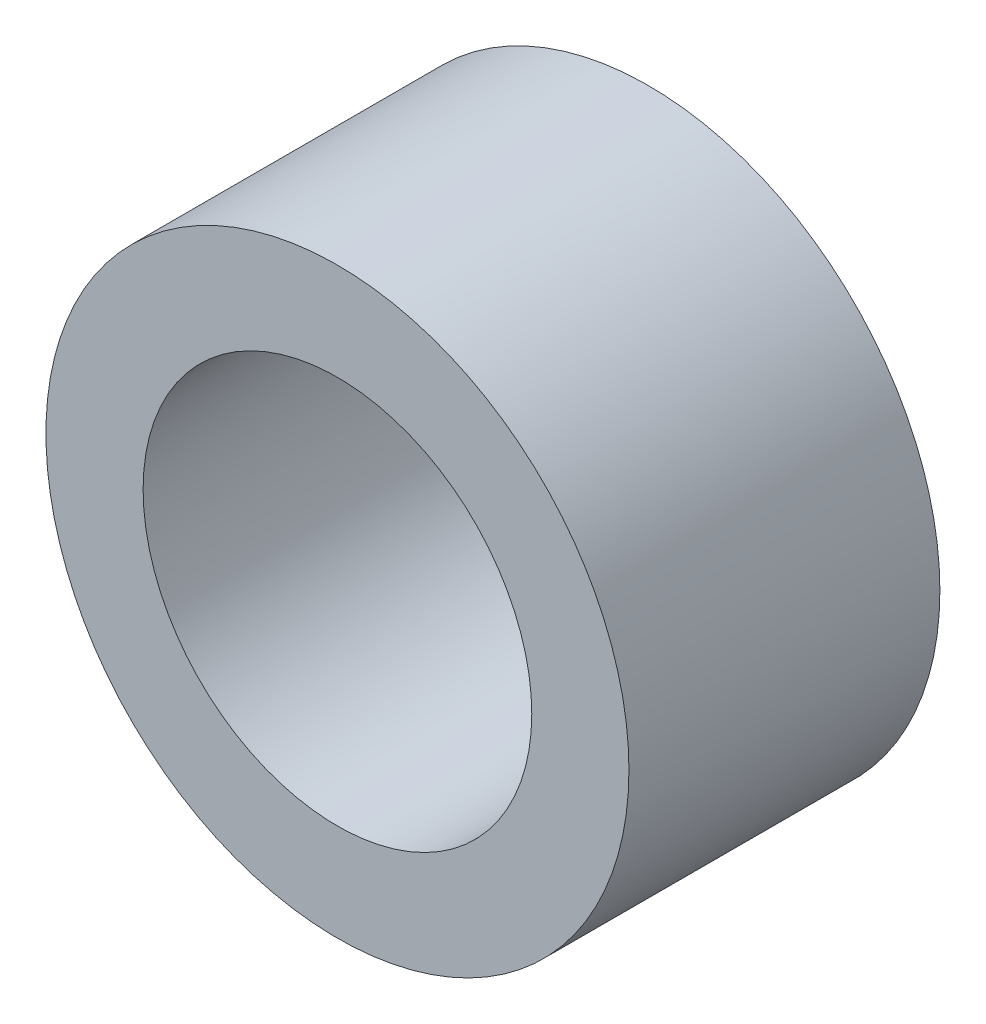
from build123d import *

# Parameters (mm, degrees)
SKETCH1_R           = 30
SKETCH1_R_2         = 20
BOSS_EXTRUDE1_DEPTH = 16


with BuildPart() as part:
    # Sketch1 → Boss-Extrude1 (new, symmetric)
    with BuildSketch(Plane.XY):
        Circle(SKETCH1_R)
        Circle(SKETCH1_R_2, mode=Mode.SUBTRACT)
    extrude(amount=BOSS_EXTRUDE1_DEPTH, both=True)


solid = part.part
